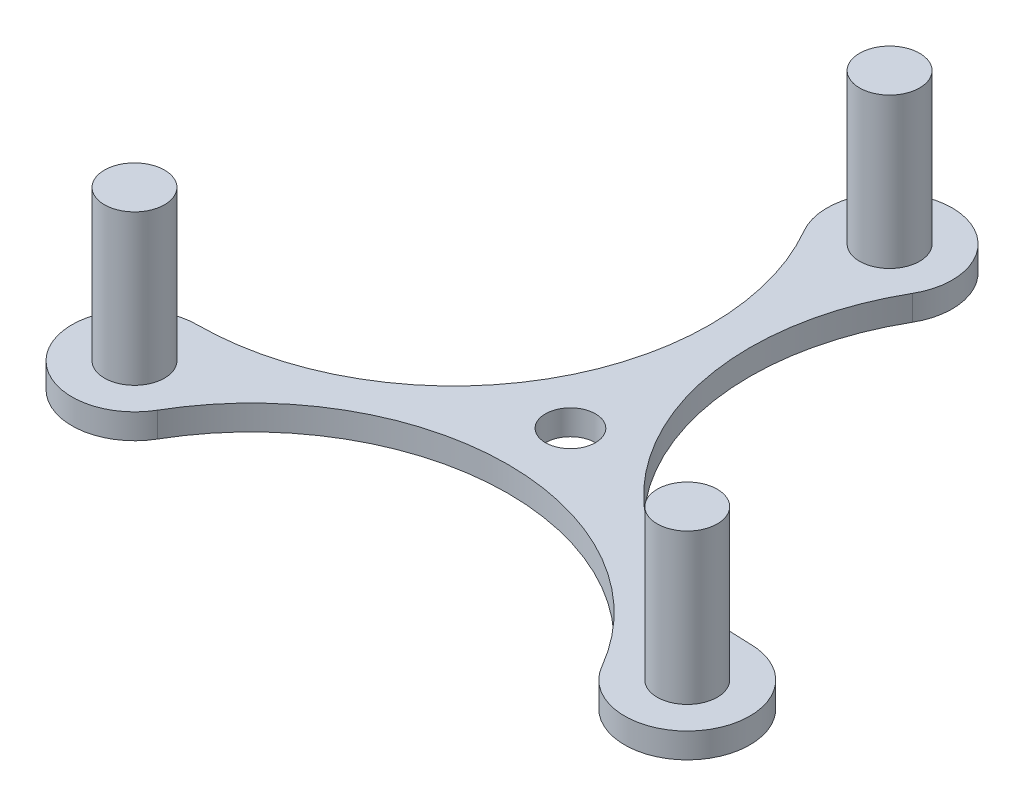
from build123d import *

# Parameters (mm, degrees)
SKETCH1_R           = 2.4
SKETCH1_R_2         = 2
BOSS_EXTRUDE1_DEPTH = 2
BOSS_EXTRUDE2_START = 2
SKETCH1_3_R         = 2.4
BOSS_EXTRUDE2_DEPTH = 12


with BuildPart() as part:
    # Sketch1 → Boss-Extrude1 (new body)
    # profile 1 of 4: a face of its own
    with BuildSketch(Plane(origin=(0, 0, 0), x_dir=(1, 0, 0), z_dir=(0, 1, 0))):
        with BuildLine():
            ThreePointArc((22.083647797, -7.75), (4.330127019, 2.5), (4.330127019, 23))
            ThreePointArc((4.330127019, 23), (4.760296424, 23.970432103), (4.975912761, 25.009803922))
            ThreePointArc((4.975912761, 25.009803922), (0, 30.5), (-4.975912761, 25.009803922))
            ThreePointArc((-4.975912761, 25.009803922), (-4.760296424, 23.970432103), (-4.330127019, 23))
            ThreePointArc((-4.330127019, 23), (-2.282168358, 18.055790425), (-1.583647797, 12.75))
            ThreePointArc((-1.583647797, 12.75), (-7.587958782, -1.745689014), (-22.083647797, -7.75))
            ThreePointArc((-22.083647797, -7.75), (-23.139151353, -7.862678418), (-24.14708192, -8.195635103))
            ThreePointArc((-24.14708192, -8.195635103), (-26.413774815, -15.25), (-19.171169159, -16.814168819))
            ThreePointArc((-19.171169159, -16.814168819), (-18.378854928, -16.107753684), (-17.753520778, -15.25))
            ThreePointArc((-17.753520778, -15.25), (0, -5), (17.753520778, -15.25))
            ThreePointArc((17.753520778, -15.25), (18.378854928, -16.107753684), (19.171169159, -16.814168819))
            ThreePointArc((19.171169159, -16.814168819), (26.413774815, -15.25), (24.14708192, -8.195635103))
            ThreePointArc((24.14708192, -8.195635103), (23.139151353, -7.862678418), (22.083647797, -7.75))
        make_face()
        with Locations((-22.083647797, -12.75)):
            Circle(SKETCH1_R, mode=Mode.SUBTRACT)
        with Locations((22.083647797, -12.75)):
            Circle(SKETCH1_R, mode=Mode.SUBTRACT)
        with Locations(Location((0, 0, 0), (0, 0, 270))):
            Circle(SKETCH1_R_2, mode=Mode.SUBTRACT)
        with Locations((0, 25.5)):
            Circle(SKETCH1_R, mode=Mode.SUBTRACT)
    # profile 2 of 4: a face of its own
    with BuildSketch(Plane(origin=(0, 0, 0), x_dir=(1, 0, 0), z_dir=(0, 1, 0))):
        with Locations((-22.083647797, -12.75)):
            Circle(SKETCH1_R)
    # profile 3 of 4: a face of its own
    with BuildSketch(Plane(origin=(0, 0, 0), x_dir=(1, 0, 0), z_dir=(0, 1, 0))):
        with Locations((22.083647797, -12.75)):
            Circle(SKETCH1_R)
    # profile 4 of 4: a face of its own
    with BuildSketch(Plane(origin=(0, 0, 0), x_dir=(1, 0, 0), z_dir=(0, 1, 0))):
        with Locations((0, 25.5)):
            Circle(SKETCH1_R)
    extrude(amount=BOSS_EXTRUDE1_DEPTH)

    # Sketch1<3> → Boss-Extrude2 (add)
    with BuildSketch(Plane(origin=(0, 0, 0), x_dir=(1, 0, 0), z_dir=(0, 1, 0)).offset(BOSS_EXTRUDE2_START)):
        with Locations(Location((-22.083647797, -12.75, 0), (0, 0, 270))):
            Circle(SKETCH1_3_R)
        with Locations(Location((22.083647797, -12.75, 0), (0, 0, 270))):
            Circle(SKETCH1_3_R)
        with Locations(Location((0, 25.5, 0), (0, 0, 270))):
            Circle(SKETCH1_3_R)
    extrude(amount=BOSS_EXTRUDE2_DEPTH)


solid = part.part
